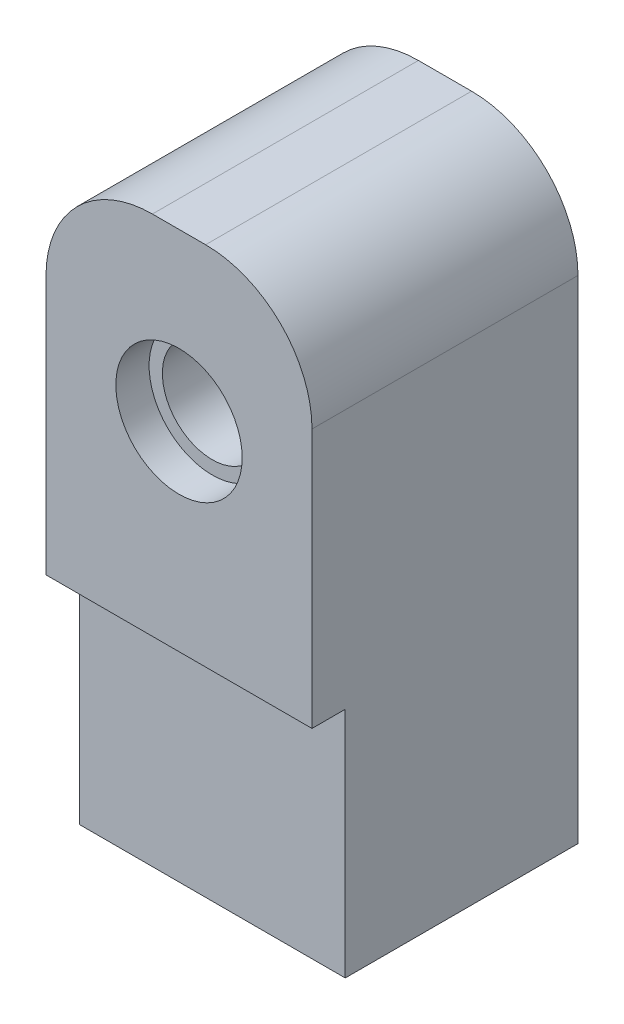
from build123d import *

# Parameters (mm, degrees)
SKETCH1_W           = 1
SKETCH1_H           = 1
BOSS_EXTRUDE1_DEPTH = 2.25
SKETCH3_W           = 1
SKETCH3_H           = 0.125
CUT_EXTRUDE4_DEPTH  = 0.875
SKETCH5_R           = 0.2375
CUT_EXTRUDE5_DEPTH  = 0.125
SKETCH6_R           = 0.1875
CUT_EXTRUDE6_DEPTH  = 0.875
SKETCH7_R           = 0.25
CUT_EXTRUDE7_DEPTH  = 1.188
FILLET1_R           = 0.4
FILLET2_R           = 0.4


with BuildPart() as part:
    # Sketch1 → Boss-Extrude1 (new body)
    with BuildSketch(Plane(origin=(0, 0, 0), x_dir=(1, 0, 0), z_dir=(0, 1, 0))):
        Rectangle(SKETCH1_W, SKETCH1_H)
    extrude(amount=BOSS_EXTRUDE1_DEPTH)

    # Sketch3 → Cut-Extrude4 (cut)
    with BuildSketch(Plane(origin=(0, 0.875, 0), x_dir=(1, 0, 0), z_dir=(0, 1, 0))):
        with Locations((0, -0.4375)):
            Rectangle(SKETCH3_W, SKETCH3_H)
    extrude(amount=-CUT_EXTRUDE4_DEPTH, mode=Mode.SUBTRACT)

    # Sketch5 → Cut-Extrude5 (cut)
    with BuildSketch(Plane.XY.offset(0.5)):
        with Locations((0, 1.625)):
            Circle(SKETCH5_R)
    extrude(amount=-CUT_EXTRUDE5_DEPTH, mode=Mode.SUBTRACT)

    # Sketch6 → Cut-Extrude6 (cut)
    with BuildSketch(Plane.XY.offset(0.375)):
        with Locations((0, 1.625)):
            Circle(SKETCH6_R)
    extrude(amount=-CUT_EXTRUDE6_DEPTH, mode=Mode.SUBTRACT)

    # Sketch7 → Cut-Extrude7 (cut)
    with BuildSketch(Plane(origin=(0, 0, 0), x_dir=(1, 0, 0), z_dir=(0, 1, 0))):
        with Locations(Location((0, 0, 0), (0, 0, 270))):
            Circle(SKETCH7_R)
    extrude(amount=CUT_EXTRUDE7_DEPTH, mode=Mode.SUBTRACT)

    # Fillet1
    fillet1_edges = [part.edges().sort_by_distance(p)[0] for p in [
        (0.5, 2.25, 0),
    ]]
    fillet(fillet1_edges, radius=FILLET1_R)

    # Fillet2
    fillet2_edges = [part.edges().sort_by_distance(p)[0] for p in [
        (-0.5, 2.25, 0),
    ]]
    fillet(fillet2_edges, radius=FILLET2_R)


solid = part.part
